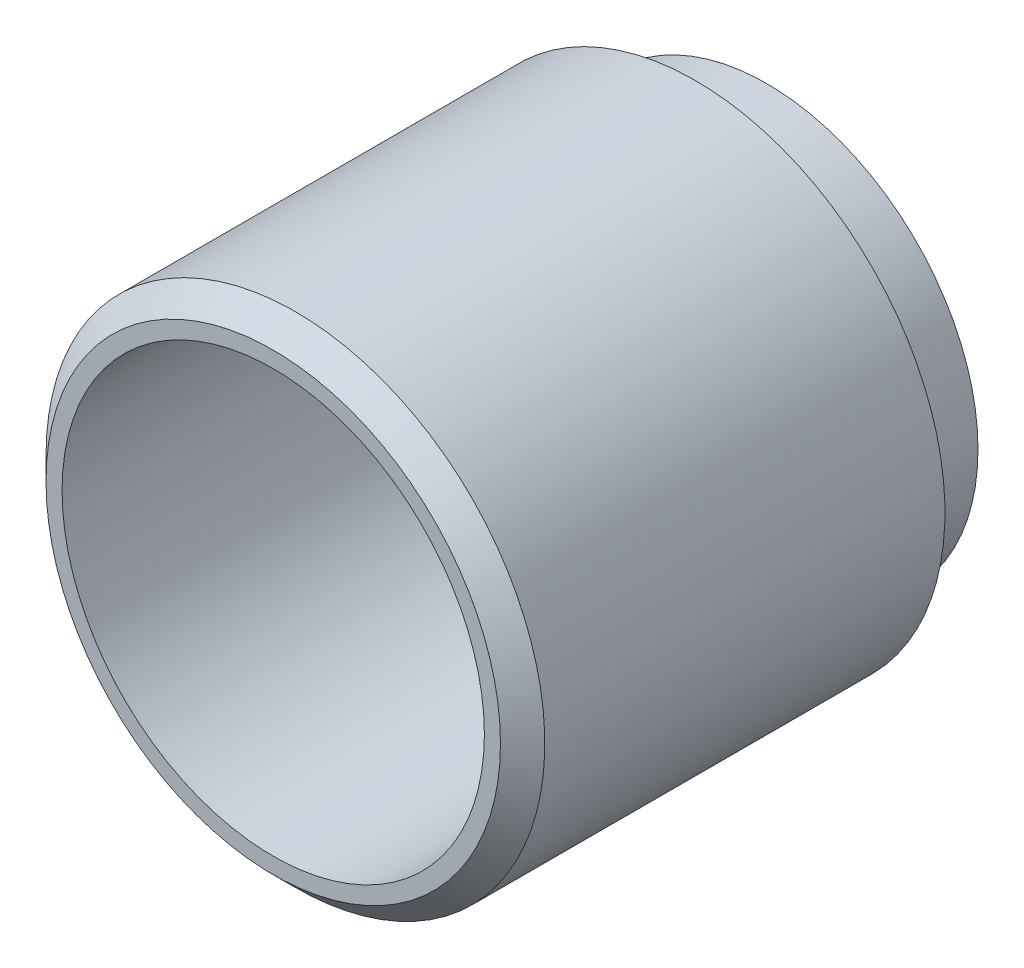
from build123d import *

# Parameters (mm, degrees)
SKETCH1_R           = 22.5
SKETCH1_R_2         = 19.05
BOSS_EXTRUDE1_DEPTH = 38.1
SKETCH2_R           = 19.05
SKETCH2_R_2         = 15.875
BOSS_EXTRUDE2_DEPTH = 6.431433883
CHAMFER1_SIZE       = 2


with BuildPart() as part:
    # Sketch1 → Boss-Extrude1 (new body)
    with BuildSketch(Plane.XY):
        with Locations(Location((-70, 40, 0), (0, 0, 180))):
            Circle(SKETCH1_R)
        with Locations(Location((-70, 40, 0), (0, 0, 180))):
            Circle(SKETCH1_R_2, mode=Mode.SUBTRACT)
    extrude(amount=BOSS_EXTRUDE1_DEPTH)

    # Chamfer1
    chamfer1_edges = [part.edges().sort_by_distance(p)[0] for p in [
        (-47.5, 40, 38.1),
    ]]
    chamfer(chamfer1_edges, length=CHAMFER1_SIZE)


with BuildPart() as body_2:
    # Sketch2 → Boss-Extrude2 (new body)
    with BuildSketch(Plane.XY):
        with Locations((-70, 40)):
            Circle(SKETCH2_R)
        with Locations((-70, 40)):
            Circle(SKETCH2_R_2, mode=Mode.SUBTRACT)
    extrude(amount=-BOSS_EXTRUDE2_DEPTH)


solid = Compound([part.part, body_2.part])
